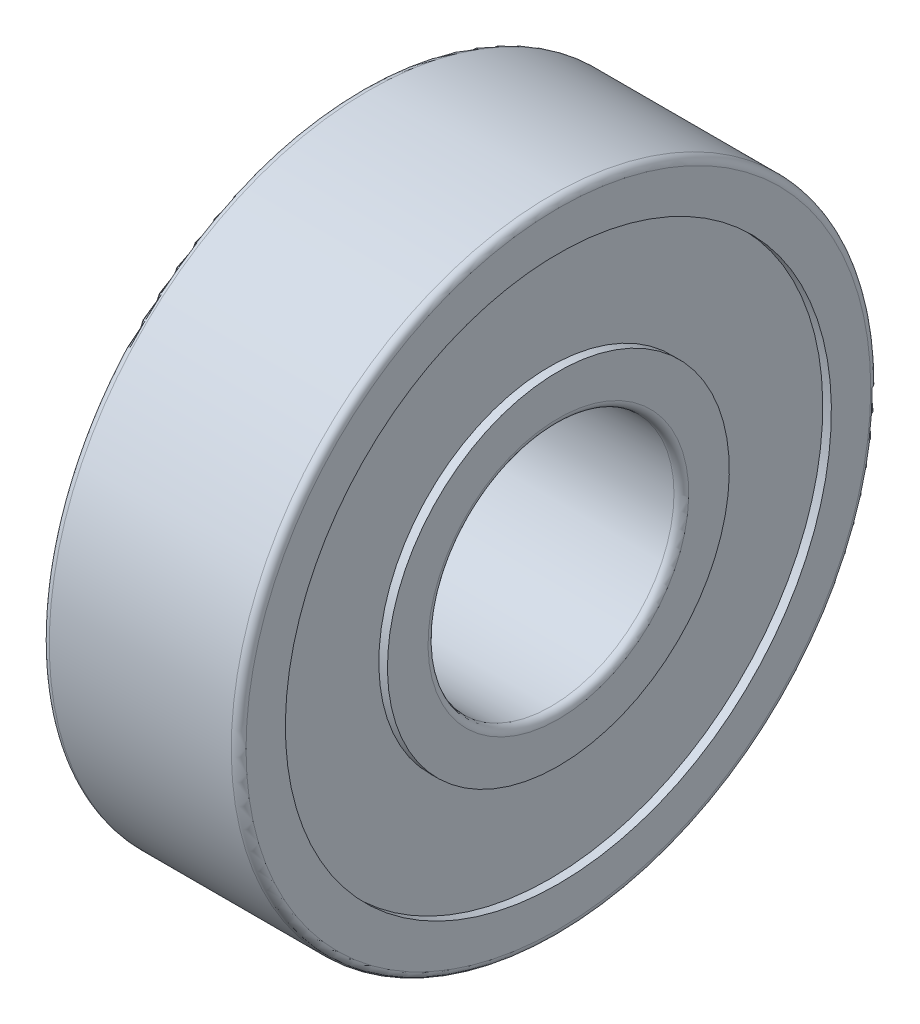
from build123d import *

# Parameters (mm, degrees)
FILLET1_R = 0.3


with BuildPart() as part:
    # Sketch1 → Revolve1 (revolve)
    with BuildSketch(Plane.XY, mode=Mode.PRIVATE) as revolve1_sk:
        Polygon((0, 5), (0, 6.95), (0.35, 6.95), (0.35, 11.1), (0, 11.1), (0, 13), (8, 13), (8, 11.1), (7.65, 11.1), (7.65, 6.95), (8, 6.95), (8, 5), align=None)
    revolve(revolve1_sk.sketch.rotate(Axis((0, 0, 0), (1, 0, 0)), 180), axis=Axis((0, 0, 0), (1, 0, 0)))

    # Fillet1
    fillet1_edges = [part.edges().sort_by_distance(p)[0] for p in [
        (8, 13, 0),
        (0, 13, 0),
        (0, 5, 0),
        (8, 5, 0),
    ]]
    fillet(fillet1_edges, radius=FILLET1_R)


solid = part.part
